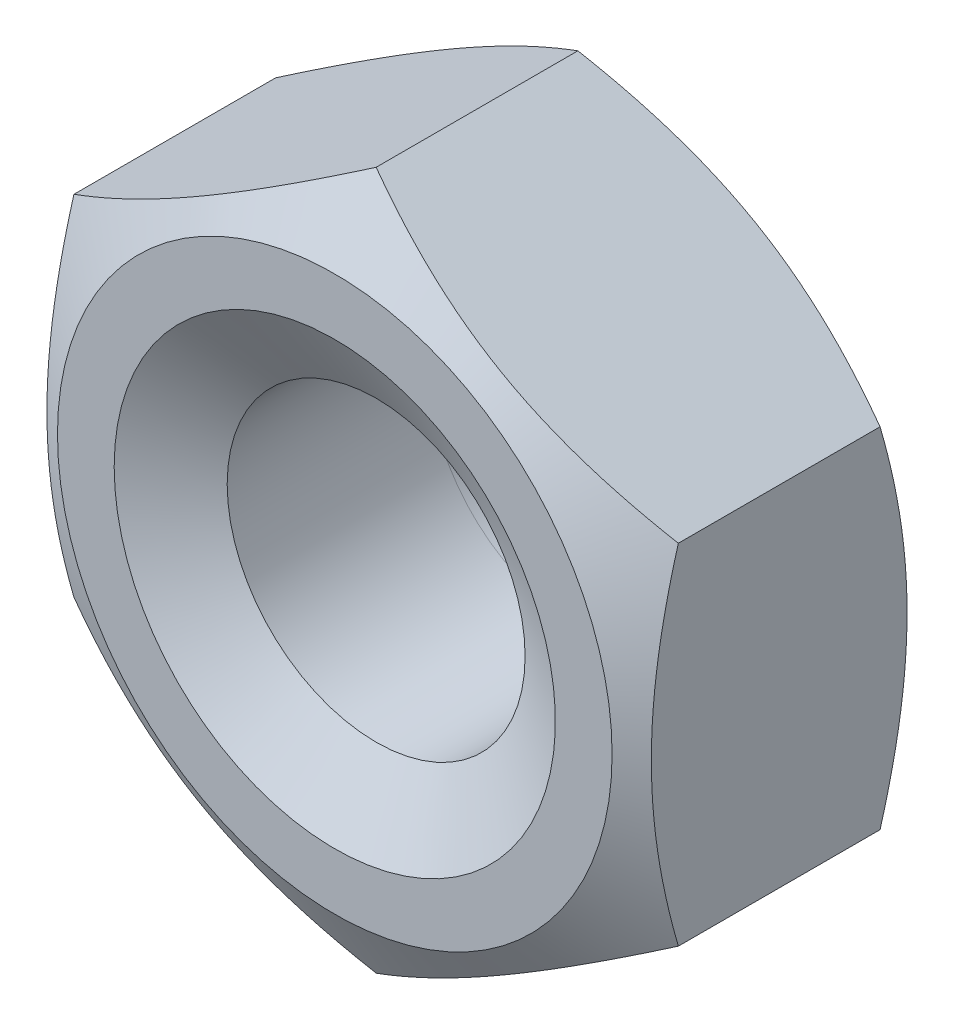
from build123d import *

# Parameters (mm, degrees)
SKETCH_1_R        = 4.19
EXTRUDE_777_DEPTH = 8


with BuildPart() as part:
    # Эскиз1 → Extrude 777 (new body)
    with BuildSketch(Plane.XY):
        Polygon((0, 9.814954576), (-8.5, 4.907477288), (-8.5, -4.907477288), (0, -9.814954576), (8.5, -4.907477288), (8.5, 4.907477288), align=None)
        Circle(SKETCH_1_R, mode=Mode.SUBTRACT)
    extrude(amount=EXTRUDE_777_DEPTH)

    # Эскиз2 → Вырез-Повернуть1 (revolve, cut)
    with BuildSketch(Plane(origin=(0, 0, 0), x_dir=(0, 0, -1), z_dir=(1, 0, 0))):
        Polygon((-8, 7.8), (-8, 9.814954576), (-6.836665433, 9.814954576), align=None)
        Polygon((-6.836665433, 4.19), (-8, 4.19), (-8, 6.204954576), align=None)
        Polygon((0, 6.204954576), (0, 4.19), (-1.163334567, 4.19), align=None)
        Polygon((0, 7.8), (-1.163334567, 9.814954576), (0, 9.814954576), align=None)
    revolve(axis=Axis((0, 0, 0), (0, 0, 1)), mode=Mode.SUBTRACT)


with BuildPart() as body_2:
    # Эскиз2<3> → Revolve 1098 (revolve)
    with BuildSketch(Plane(origin=(0, 0, 0), x_dir=(0, 0, -1), z_dir=(1, 0, 0))):
        Polygon((0, 4.19), (0, 6.204954576), (-1.163334567, 4.19), align=None)
    revolve(axis=Axis((0, 0, 0), (0, 0, 1)))


solid = Compound([part.part, body_2.part])
